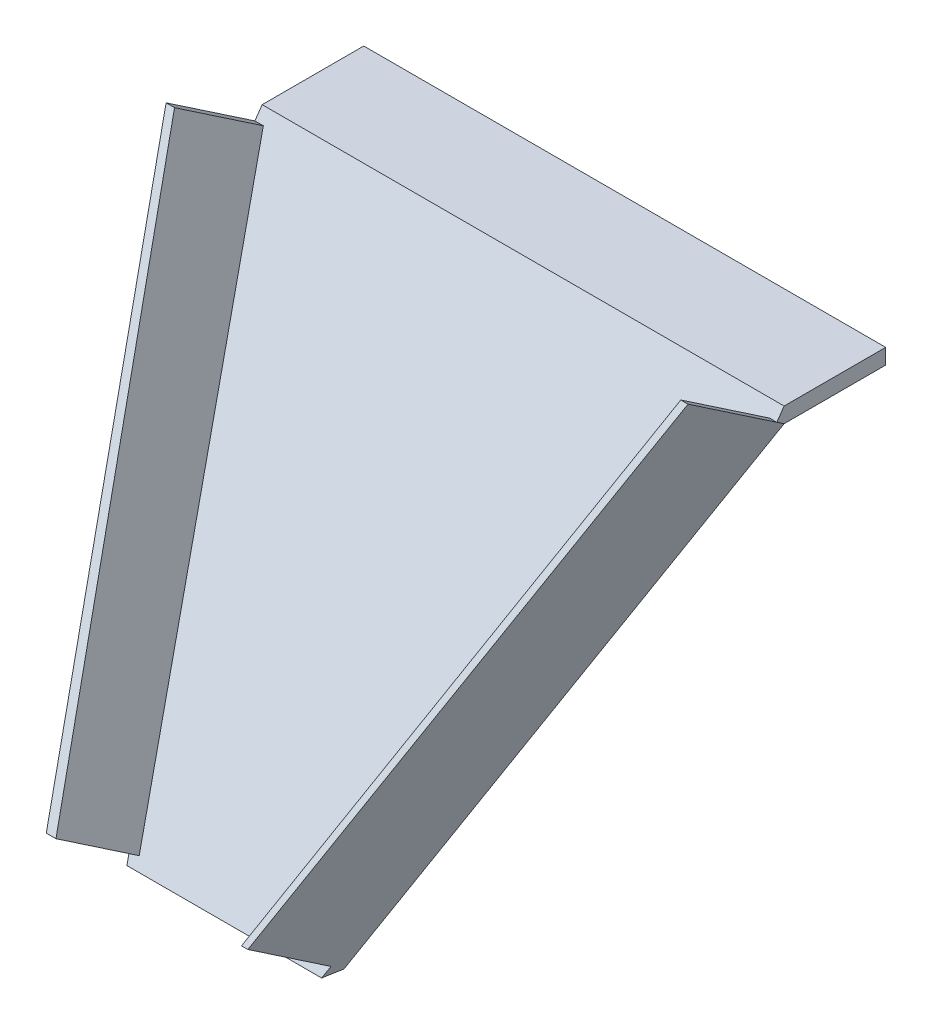
from build123d import *

# Parameters (mm, degrees)
BOSS_EXTRUDE1_DEPTH          = 90
CUT_EXTRUDE_THIN5_DEPTH      = 107.179219538
CUT_EXTRUDE_THIN5_DEPTH_BACK = 90
CUT_EXTRUDE_THIN6_DEPTH      = 107.179219538
CUT_EXTRUDE_THIN6_DEPTH_BACK = 90
BOSS_EXTRUDE2_DEPTH          = 20
BOSS_EXTRUDE3_DEPTH          = 20


with BuildPart() as part:
    # Sketch1 → Boss-Extrude1 (new body)
    with BuildSketch(Plane(origin=(0, 0, 0), x_dir=(0, 0, -1), z_dir=(1, 0, 0))):
        Polygon((-25.714309173, -36.929314965), (25.714309173, 36.929314965), (43.232455695, 36.929314965), (43.232455695, 34.281986352), (25.714309173, 34.281986352), (-22.460611748, -36.929314965), align=None)
    extrude(amount=BOSS_EXTRUDE1_DEPTH)

    # Sketch5 → Cut-Extrude-Thin5 (cut, two sides: drawn at the far end of the back side and taken through both)
    with BuildSketch(Plane(origin=(0, -1.17061758, -1.730385845), x_dir=(-1, 0, 0), z_dir=(0, -0.560329875322556, -0.8282695399572587)).offset(-CUT_EXTRUDE_THIN5_DEPTH_BACK)):
        Polygon((-90, 42.803220717), (-61.682852786, -44.99592237), (-90.234601267, -54.204486788), (-118.551748482, 33.594656299), align=None)
    extrude(amount=CUT_EXTRUDE_THIN5_DEPTH + CUT_EXTRUDE_THIN5_DEPTH_BACK, mode=Mode.SUBTRACT)

    # Sketch6 → Cut-Extrude-Thin6 (cut, two sides: drawn at the far end of the back side and taken through both)
    with BuildSketch(Plane(origin=(0, -1.17061758, -1.730385845), x_dir=(-1, 0, 0), z_dir=(0, -0.560329875322556, -0.8282695399572587)).offset(-CUT_EXTRUDE_THIN6_DEPTH_BACK)):
        Polygon((0, 42.803220717), (-28.102327933, -44.99592237), (0.469772757, -54.141143098), (28.57210069, 33.657999989), align=None)
    extrude(amount=CUT_EXTRUDE_THIN6_DEPTH + CUT_EXTRUDE_THIN6_DEPTH_BACK, mode=Mode.SUBTRACT)

    # Sketch7 → Boss-Extrude2 (add)
    with BuildSketch(Plane(origin=(0, -1.17061758, -1.730385845), x_dir=(-1, 0, 0), z_dir=(0, -0.560329875322556, -0.8282695399572587))):
        Polygon((-88.752727637, 42.803220717), (-61.177479126, -43.172778497), (-62.270856627, -43.172778497), (-90, 42.803220717), align=None)
    extrude(amount=-BOSS_EXTRUDE2_DEPTH)

    # Sketch8 → Boss-Extrude3 (add)
    with BuildSketch(Plane(origin=(0, -1.17061758, -1.730385845), x_dir=(-1, 0, 0), z_dir=(0, -0.560329875322556, -0.8282695399572587))):
        Polygon((0, 42.803220717), (-1.455878042, 42.803220717), (-29.184434589, -43.172778497), (-27.518784801, -43.172778497), align=None)
    extrude(amount=-BOSS_EXTRUDE3_DEPTH)


solid = part.part
